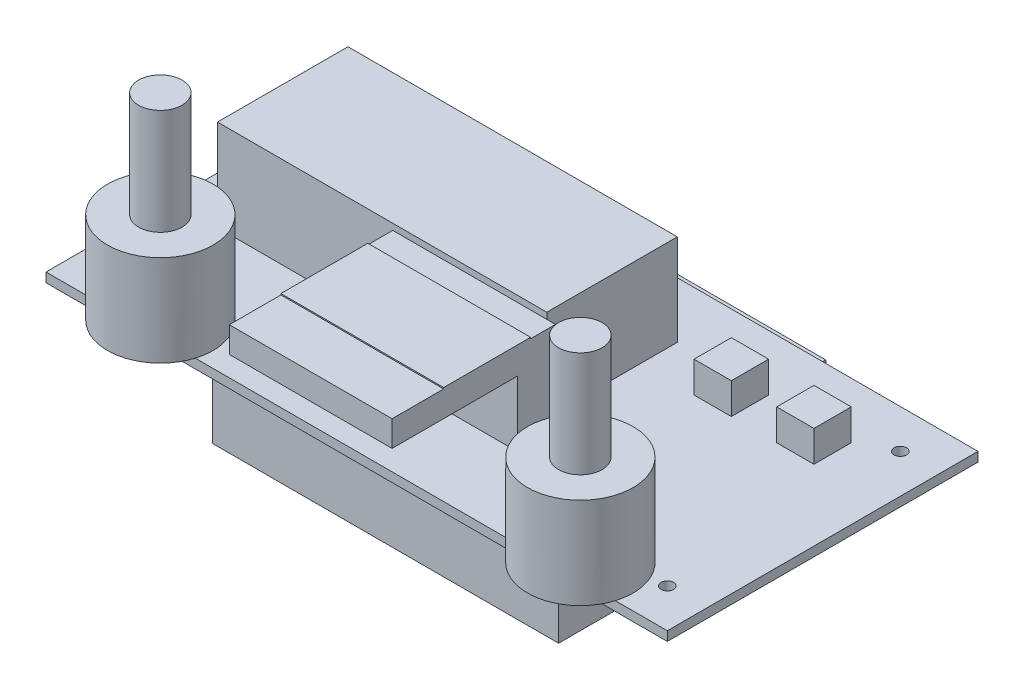
from build123d import *

# Parameters (mm, degrees)
ESBO_O1_W                = 100
ESBO_O1_H                = 50
ESBO_O1_R                = 1
RESSALTO_EXTRUS_O1_DEPTH = 1.5
ESBO_O2_R                = 8.5
ESBO_O2_W                = 53
ESBO_O2_H                = 21
ESBO_O2_W_2              = 6
ESBO_O2_H_2              = 6
ESBO_O2_W_3              = 26.2
ESBO_O2_H_3              = 26.3
RESSALTO_EXTRUS_O4_DEPTH = 14.7
ESBO_O3_W                = 22.891769865
ESBO_O3_H                = 8.050029258
CORTE_EXTRUS_O1_DEPTH    = 9.7
ESBO_O4_R                = 3.5
RESSALTO_EXTRUS_O5_DEPTH = 17
ESBO_O5_W                = 55.7
ESBO_O5_H                = 43
RESSALTO_EXTRUS_O6_DEPTH = 18
ESBO_O6_W                = 26.2
ESBO_O6_H                = 14
RESSALTO_EXTRUS_O7_DEPTH = 0.2
ESBO_O7_W                = 26.2
ESBO_O7_H                = 10.560021921
CORTE_EXTRUS_O2_DEPTH    = 20.2


with BuildPart() as part:
    # Esboço1 → Ressalto-extrusão1 (new body)
    with BuildSketch(Plane(origin=(0, 0, 0), x_dir=(1, 0, 0), z_dir=(0, 1, 0))):
        Rectangle(ESBO_O1_W, ESBO_O1_H)
        with Locations(Location((43.75, 18.75, 0), (0, 0, 270))):
            Circle(ESBO_O1_R, mode=Mode.SUBTRACT)
        with Locations(Location((43.75, -18.75, 0), (0, 0, 270))):
            Circle(ESBO_O1_R, mode=Mode.SUBTRACT)
        with Locations(Location((-43.75, 18.749999801, 0), (0, 0, 270))):
            Circle(ESBO_O1_R, mode=Mode.SUBTRACT)
        with Locations(Location((-43.751173924, -18.750000181, 0), (0, 0, 270))):
            Circle(ESBO_O1_R, mode=Mode.SUBTRACT)
    extrude(amount=RESSALTO_EXTRUS_O1_DEPTH)

    # Esboço2 → Ressalto-extrusão4 (add)
    with BuildSketch(Plane(origin=(0, 1.5, 0), x_dir=(1, 0, 0), z_dir=(0, 1, 0))):
        with Locations(Location((33.5, -22.5, 0), (0, 0, 342.895364823))):
            Circle(ESBO_O2_R)
        with Locations(Location((-34.1, -22.5, 0), (0, 0, 197.104635177))):
            Circle(ESBO_O2_R)
        with Locations((-15.9, 5.5)):
            Rectangle(ESBO_O2_W, ESBO_O2_H)
        with Locations((22.3, 13)):
            Rectangle(ESBO_O2_W_2, ESBO_O2_H_2)
        with Locations((35.6, 13)):
            Rectangle(ESBO_O2_W_2, ESBO_O2_H_2)
        with Locations((-0.1, -19.15)):
            Rectangle(ESBO_O2_W_3, ESBO_O2_H_3)
    extrude(amount=RESSALTO_EXTRUS_O4_DEPTH)

    # Esboço3 → Corte-extrusão1 (cut)
    with BuildSketch(Plane(origin=(0, 16.2, 0), x_dir=(1, 0, 0), z_dir=(0, 1, 0))):
        with Locations((27.154115068, 14.025014629)):
            Rectangle(ESBO_O3_W, ESBO_O3_H)
    extrude(amount=-CORTE_EXTRUS_O1_DEPTH, mode=Mode.SUBTRACT)

    # Esboço4 → Ressalto-extrusão5 (add)
    with BuildSketch(Plane(origin=(0, 16.2, 0), x_dir=(1, 0, 0), z_dir=(0, 1, 0))):
        with Locations(Location((33.5, -22.5, 0), (0, 0, 270))):
            Circle(ESBO_O4_R)
        with Locations(Location((-34.1, -22.5, 0), (0, 0, 270))):
            Circle(ESBO_O4_R)
    extrude(amount=RESSALTO_EXTRUS_O5_DEPTH)

    # Esboço5 → Ressalto-extrusão6 (add)
    with BuildSketch(Plane.XZ):
        with Locations((-4.35, -5.5)):
            Rectangle(ESBO_O5_W, ESBO_O5_H)
    extrude(amount=RESSALTO_EXTRUS_O6_DEPTH)

    # Esboço6 → Ressalto-extrusão7 (add)
    with BuildSketch(Plane(origin=(0, 16.2, 0), x_dir=(1, 0, 0), z_dir=(0, 1, 0))):
        with Locations((-0.1, -17)):
            Rectangle(ESBO_O6_W, ESBO_O6_H)
    extrude(amount=RESSALTO_EXTRUS_O7_DEPTH)

    # Esboço7 → Corte-extrusão2 (cut)
    with BuildSketch(Plane.XY.offset(32.3)):
        with Locations((-0.1, 6.780010961)):
            Rectangle(ESBO_O7_W, ESBO_O7_H)
    extrude(amount=-CORTE_EXTRUS_O2_DEPTH, mode=Mode.SUBTRACT)


solid = part.part
